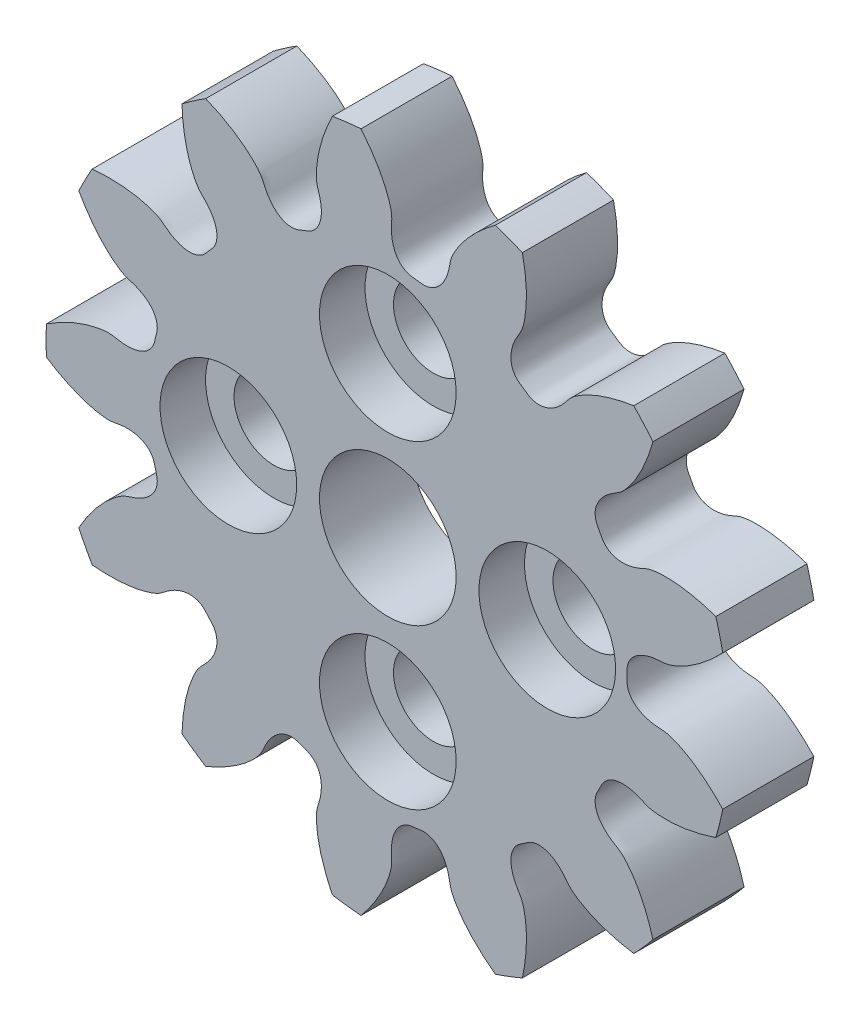
from build123d import *

# Parameters (mm, degrees)
SKETCHREVOLVESPURGEAR1_W       = 4
SKETCHREVOLVESPURGEAR1_H       = 14.999999775
TOOTHEXTRUDECUTSPURGEAR1_DEPTH = 2
PATTERNSPURGEAR1_COUNT         = 13
BOREREVOLVESKETCH_W            = 4
BOREREVOLVESKETCH_H            = 3
SKETCH1_R                      = 1.75
CUT_EXTRUDE1_DEPTH             = 22.554921832
SKETCH2_R                      = 3
CUT_EXTRUDE2_DEPTH             = 2


with BuildPart() as part:
    # SketchRevolveSpurGear1 → SpurGear1 (revolve)
    with BuildSketch(Plane(origin=(0, 0, 0), x_dir=(0, 0, -1), z_dir=(1, 0, 0))):
        with Locations((0, 7.499999888)):
            Rectangle(SKETCHREVOLVESPURGEAR1_W, SKETCHREVOLVESPURGEAR1_H)
    revolve(axis=Axis((0, 0, 0), (0, 0, -1)))

    # SketchToothSpurGear1 → ToothExtrudeCutSpurGear1 (cut, symmetric)
    with BuildSketch(Plane.XY):
        with BuildLine():
            ThreePointArc((14.786400007, 3.061432344), (15.099999773, 0), (14.786400007, -3.061432344))
            add(Edge.make_bspline(
                [(14.786400007, -3.061432344), (14.648956152, -2.910405475), (14.440609979, -2.696686857), (14.155399149, -2.435113717), (13.952919851, -2.262517317), (13.756954188, -2.107389531), (13.568487186, -1.969016622), (13.388460197, -1.846636359), (13.217768566, -1.739441661), (13.057259989, -1.646579852), (12.907731292, -1.56716489), (12.769930738, -1.500248139), (12.644543089, -1.444922723), (12.532229714, -1.400005453), (12.433498451, -1.365029288), (12.150054386, -1.271831548), (11.845679211, -1.294977496), (11.554024399, -1.23714367), (11.461499015, -1.215497672), (11.371915667, -1.190129897), (11.285167031, -1.161163096), (11.201202629, -1.128363883), (11.119962728, -1.091505009), (11.041413223, -1.050252188), (10.965564821, -1.004174365), (10.892511611, -0.952724776), (10.822484809, -0.895240296), (10.755927281, -0.83095953), (10.693583574, -0.759080157), (10.636600905, -0.678875316), (10.586569924, -0.58989139), (10.545592137, -0.492204664), (10.515735118, -0.386749801), (10.501619307, -0.286258964), (10.495765542, -0.156800527), (10.502983696, 0), (10.495765542, 0.156800527), (10.501619307, 0.286258964), (10.515735118, 0.386749801), (10.545592137, 0.492204664), (10.586569924, 0.58989139), (10.636600905, 0.678875316), (10.693583574, 0.759080157), (10.755927281, 0.83095953), (10.822484809, 0.895240296), (10.892511611, 0.952724776), (10.965564821, 1.004174365), (11.041413223, 1.050252188), (11.119962728, 1.091505009), (11.201202629, 1.128363883), (11.285167031, 1.161163096), (11.371915667, 1.190129897), (11.461499015, 1.215497672), (11.554024399, 1.23714367), (11.845679211, 1.294977496), (12.150054386, 1.271831548), (12.433498451, 1.365029288), (12.532229714, 1.400005453), (12.644543089, 1.444922723), (12.769930738, 1.500248139), (12.907731292, 1.56716489), (13.057259989, 1.646579852), (13.217768566, 1.739441661), (13.388460197, 1.846636359), (13.568487186, 1.969016622), (13.756954188, 2.107389531), (13.952919851, 2.262517317), (14.155399149, 2.435113717), (14.440609979, 2.696686857), (14.648956152, 2.910405475), (14.786400007, 3.061432344)],
                knots=[0, 0, 0, 0, 0.054456227, 0.079534753, 0.103180221, 0.125392629, 0.146171979, 0.165518271, 0.183431504, 0.199911678, 0.214958794, 0.228572852, 0.240753851, 0.251501791, 0.260816673, 0.268698496, 0.330902079, 0.33953361, 0.347971299, 0.356236343, 0.364353502, 0.372351707, 0.380264718, 0.388131768, 0.395998096, 0.403915174, 0.411940296, 0.420135036, 0.428561891, 0.437278381, 0.446328155, 0.455729643, 0.465464682, 0.475471623, 0.48271519, 0.5, 0.51728481, 0.524528377, 0.534535318, 0.544270357, 0.553671845, 0.562721619, 0.571438109, 0.579864964, 0.588059704, 0.596084826, 0.604001904, 0.611868232, 0.619735282, 0.627648293, 0.635646498, 0.643763657, 0.652028701, 0.66046639, 0.669097921, 0.731301504, 0.739183327, 0.748498209, 0.759246149, 0.771427148, 0.785041206, 0.800088322, 0.816568496, 0.834481729, 0.853828021, 0.874607371, 0.896819779, 0.920465247, 0.945543773, 1, 1, 1, 1], degree=3))
        make_face()
    toothextrudecutspurgear1 = extrude(amount=TOOTHEXTRUDECUTSPURGEAR1_DEPTH, both=True, mode=Mode.SUBTRACT)

    # PatternSpurGear1: ToothExtrudeCutSpurGear1 ×13 about axis
    patternspurgear1_axis = Axis((0, 0, 55), (0, 0, -1))
    for i in range(1, PATTERNSPURGEAR1_COUNT):
        add(toothextrudecutspurgear1.rotate(patternspurgear1_axis, i * 360 / PATTERNSPURGEAR1_COUNT), mode=Mode.SUBTRACT)

    # BoreRevolveSketch → BoreRevolveCut (revolve, cut)
    with BuildSketch(Plane(origin=(0, 0, 0), x_dir=(0, 0, -1), z_dir=(1, 0, 0))):
        with Locations((0, 1.5)):
            Rectangle(BOREREVOLVESKETCH_W, BOREREVOLVESKETCH_H)
    revolve(axis=Axis((0, 0, 0), (0, 0, -1)), mode=Mode.SUBTRACT)

    # Sketch1 → Cut-Extrude1 (cut, through all)
    with BuildSketch(Plane.XY.offset(2)):
        with Locations((0, 7)):
            Circle(SKETCH1_R)
        with Locations((7, 0)):
            Circle(SKETCH1_R)
        with Locations((0, -7)):
            Circle(SKETCH1_R)
        with Locations((-7, 0)):
            Circle(SKETCH1_R)
    extrude(amount=-CUT_EXTRUDE1_DEPTH, mode=Mode.SUBTRACT)

    # Sketch2 → Cut-Extrude2 (cut)
    with BuildSketch(Plane.XY.offset(2)):
        with Locations((0, 7)):
            Circle(SKETCH2_R)
        with Locations((7, 0)):
            Circle(SKETCH2_R)
        with Locations((0, -7)):
            Circle(SKETCH2_R)
        with Locations((-7, 0)):
            Circle(SKETCH2_R)
    extrude(amount=-CUT_EXTRUDE2_DEPTH, mode=Mode.SUBTRACT)


solid = part.part
